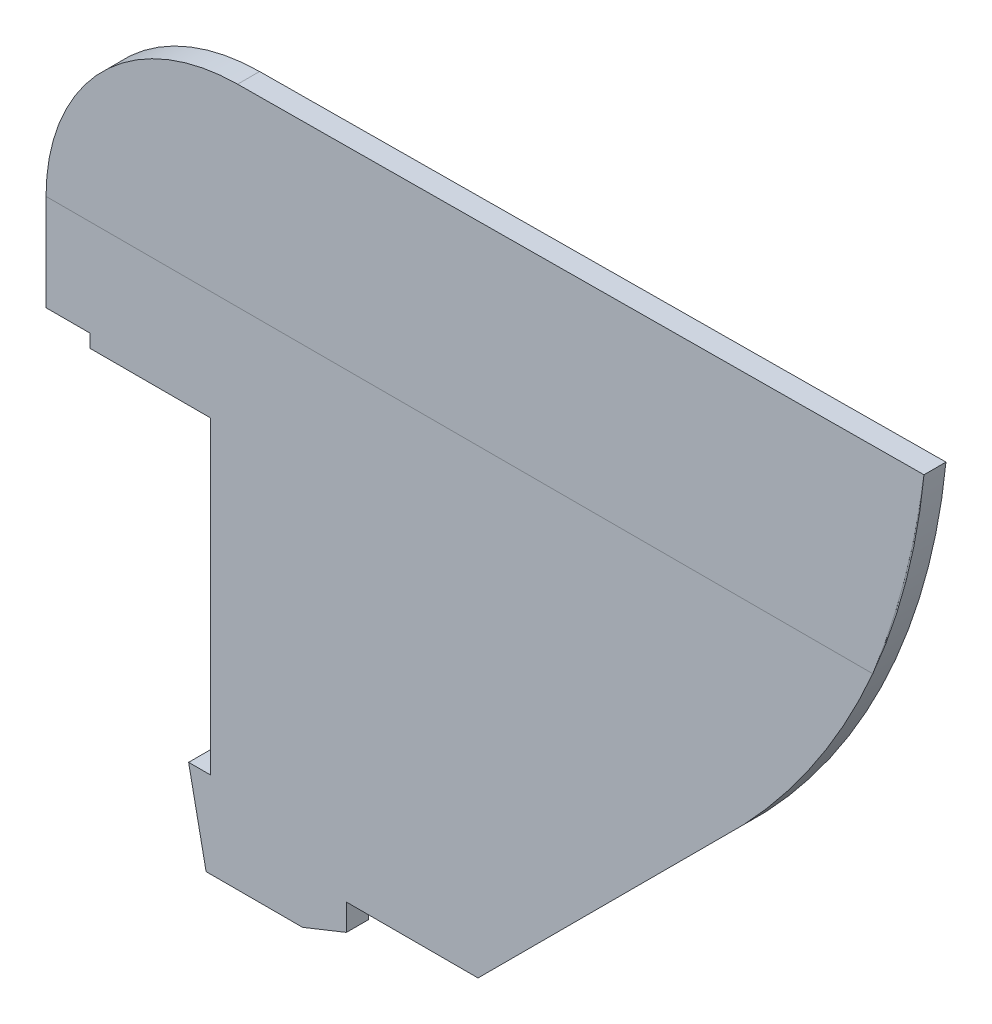
from build123d import *

# Parameters (mm, degrees)
BOSS_EXTRU_1_DEPTH      = 5
BOSS_EXTRU_2_DEPTH      = 0.01
ESQUISSE3_W             = 10
ESQUISSE3_H             = 3
ENL_V_MAT_EXTRU_1_DEPTH = 231.967242256
ENL_V_MAT_EXTRU_2_DEPTH = 231.967242256


with BuildPart() as part:
    # Esquisse1 → Boss.-Extru.1 (new body)
    with BuildSketch(Plane.XY):
        with BuildLine():
            Line((0, 0), (0, -25))
            Line((0, -25), (37.5, -25))
            Line((37.5, -25), (37.5, -95.5))
            Line((37.5, -95.5), (32.5, -95.5))
            Line((32.5, -95.5), (36.487358688, -115.098494092))
            Line((36.487358688, -115.098494092), (88.487358688, -115.098494092))
            Line((88.487358688, -115.098494092), (159.198036807, -44.387815974))
            ThreePointArc((159.198036807, -44.387815974), (187.146342861, -3.044299659), (200.182925478, 45.126663235))
            Line((200.182925478, 45.126663235), (43.682925478, 43.998857528))
            ThreePointArc((43.682925478, 43.998857528), (12.775400091, 31.000392909), (0, 0))
        make_face()
    extrude(amount=BOSS_EXTRU_1_DEPTH)

    # Esquisse2 → Boss.-Extru.2 (add)
    with BuildSketch(Plane.XY.offset(5)):
        with BuildLine():
            Line((0, 0), (188.5, 0))
            ThreePointArc((188.5, 0), (195.764398976, 22.194945018), (200.182925478, 45.126663235))
            Line((200.182925478, 45.126663235), (43.682925478, 43.998857528))
            ThreePointArc((43.682925478, 43.998857528), (12.775400091, 31.000392909), (0, 0))
        make_face()
    extrude(amount=BOSS_EXTRU_2_DEPTH)

    # Esquisse3 → Enlèv. mat.-Extru.1 (cut, through all)
    with BuildSketch(Plane.XY.offset(5)):
        with Locations((5, -23.5)):
            Rectangle(ESQUISSE3_W, ESQUISSE3_H)
    extrude(amount=-ENL_V_MAT_EXTRU_1_DEPTH, mode=Mode.SUBTRACT)

    # Esquisse4 → Enlèv. mat.-Extru.2 (cut, through all)
    with BuildSketch(Plane.XY.offset(5)):
        Polygon((88.487358688, -105.098494092), (68.487358688, -105.098494092), (68.487358688, -111.098494092), (58.487358688, -115.098494092), (68.487358688, -115.098494092), (88.487358688, -115.098494092), (98.487358688, -105.098494092), align=None)
    extrude(amount=-ENL_V_MAT_EXTRU_2_DEPTH, mode=Mode.SUBTRACT)


solid = part.part
